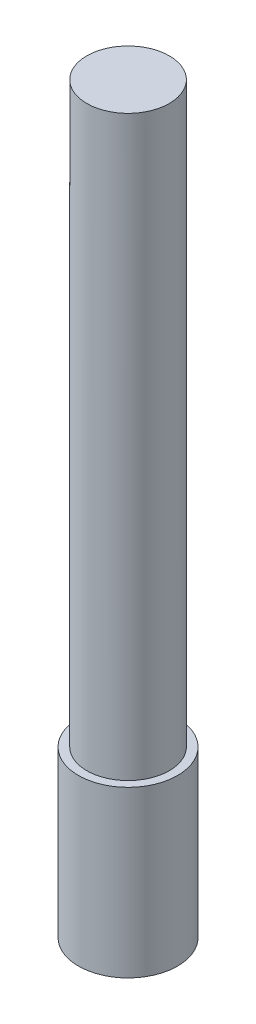
from build123d import *

# Parameters (mm, degrees)
SKETCH1_R           = 0.5
SKETCH3_R           = 0.6
BOSS_EXTRUDE1_DEPTH = 2


with BuildPart() as part:
    # Sweep1: sweep along a path in Sketch2
    with BuildLine(Plane(origin=(0, 0, 0), x_dir=(0, 0, -1), z_dir=(1, 0, 0))) as sweep1_path:
        Line((0, 0), (0, -9))
    # Sketch1 → Sweep1 (sweep)
    with BuildSketch(Plane(origin=(0, 0, 0), x_dir=(1, 0, 0), z_dir=(0, 1, 0))):
        Circle(SKETCH1_R)
    sweep(path=sweep1_path.line)

    # Sketch3 → Boss-Extrude1 (add)
    with BuildSketch(Plane.XZ.offset(9)):
        with Locations(Location((0, 0, 0), (0, 0, 270))):
            Circle(SKETCH3_R)
    extrude(amount=-BOSS_EXTRUDE1_DEPTH)


solid = part.part
